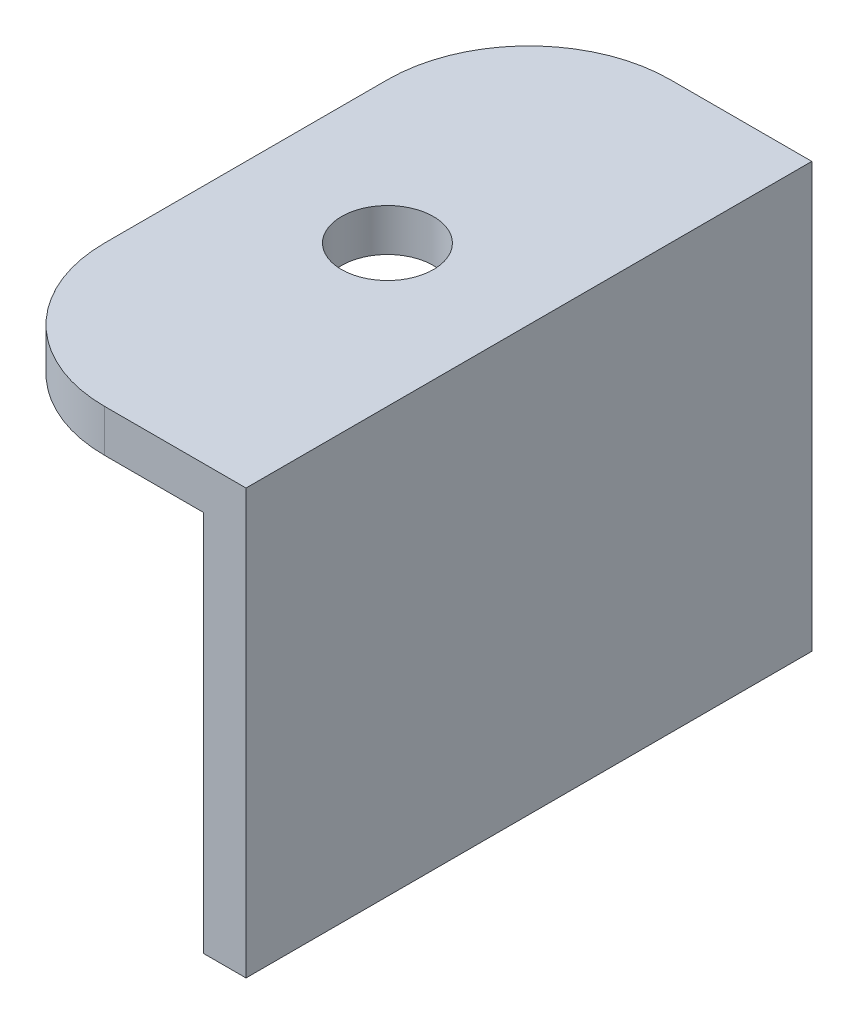
from build123d import *

# Parameters (mm, degrees)
EXTRUDE_1_DEPTH      = 20
EXTRUDE_1_DEPTH_BACK = 20
SKETCH_2_R           = 3.25
CUT_EXTRUDE_1_DEPTH  = 40
FILLET_1_R           = 10


with BuildPart() as part:
    # ｽｹｯﾁ1 → ﾎﾞｽ - 押し出し1 (new, two sides: drawn at the far end of the back side and taken through both)
    with BuildSketch(Plane.XY.offset(-EXTRUDE_1_DEPTH_BACK)):
        Polygon((-20, 0), (0, 0), (0, -30), (-3, -30), (-3, -3), (-20, -3), align=None)
    extrude(amount=EXTRUDE_1_DEPTH + EXTRUDE_1_DEPTH_BACK)

    # ｽｹｯﾁ2 → ｶｯﾄ - 押し出し1 (cut)
    with BuildSketch(Plane(origin=(0, 0, 0), x_dir=(1, 0, 0), z_dir=(0, 1, 0))):
        with Locations((-10, 0)):
            Circle(SKETCH_2_R)
    extrude(amount=-CUT_EXTRUDE_1_DEPTH, mode=Mode.SUBTRACT)

    # ﾌｨﾚｯﾄ1
    fillet_1_edges = [part.edges().sort_by_distance(p)[0] for p in [
        (-20, -1.5, -20),
        (-20, -1.5, 20),
    ]]
    fillet(fillet_1_edges, radius=FILLET_1_R)


solid = part.part
